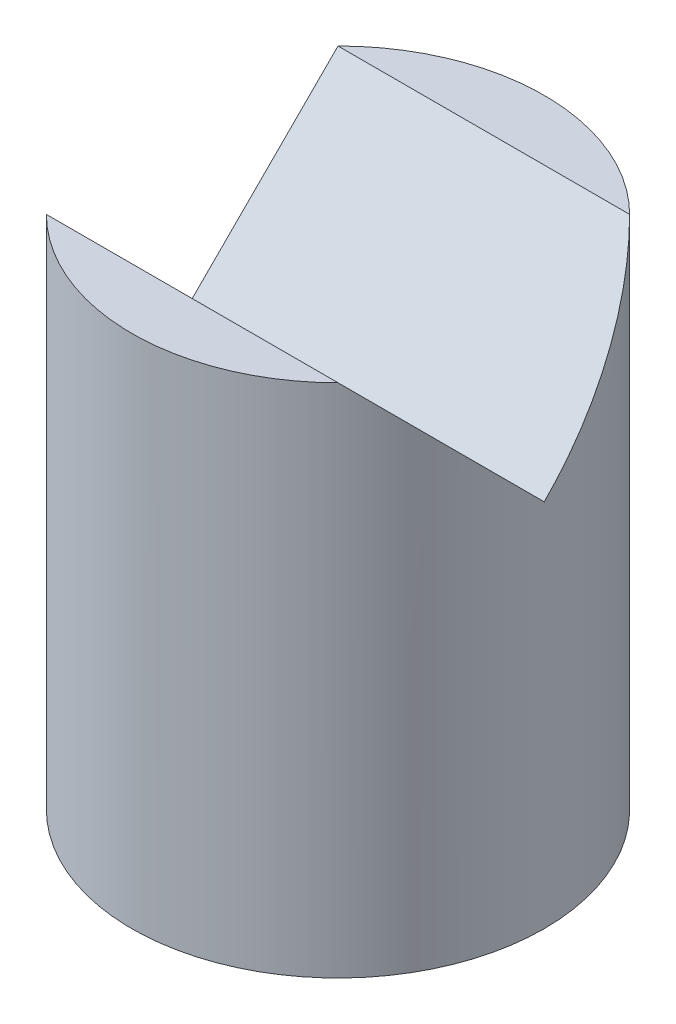
from build123d import *

# Parameters (mm, degrees)
BOSS_EXTRUDE1_DEPTH     = 10
CUT_EXTRUDE1_REACH      = 14.753
CUT_EXTRUDE1_END_RADIUS = 4


with BuildPart() as part:
    # Sketch1 → Boss-Extrude1 (new body)
    with BuildSketch(Plane(origin=(0, 0, 0), x_dir=(1, 0, 0), z_dir=(0, 1, 0))):
        with BuildLine():
            Line((-2.828427125, 2.828427125), (-2.828427125, -2.828427125))
            ThreePointArc((-2.828427125, -2.828427125), (4, 0), (-2.828427125, 2.828427125))
        make_face()
    extrude(amount=BOSS_EXTRUDE1_DEPTH)

    # Cut-Extrude1: up to this cylinder (the profile starts inside it)
    cut_extrude1_end = Plane(origin=(0, 9.057191, 0), z_dir=(0, -1, 0)) * Cylinder(CUT_EXTRUDE1_END_RADIUS, 38.506, mode=Mode.PRIVATE)
    # Sketch2 → Cut-Extrude1 (cut, up to the surface)
    with BuildSketch(Plane.ZY.offset(2.828427125), mode=Mode.PRIVATE) as cut_extrude1_sk1:
        Polygon((-2.828427125, 10), (0, 7.171572875), (2.828427125, 10), align=None)
    cut_extrude1_tool1 = extrude(cut_extrude1_sk1.sketch, amount=-CUT_EXTRUDE1_REACH, mode=Mode.PRIVATE) & cut_extrude1_end
    add(cut_extrude1_tool1.solids().sort_by_distance((-2.828427, 9.057191, 0))[0], mode=Mode.SUBTRACT)


solid = part.part
